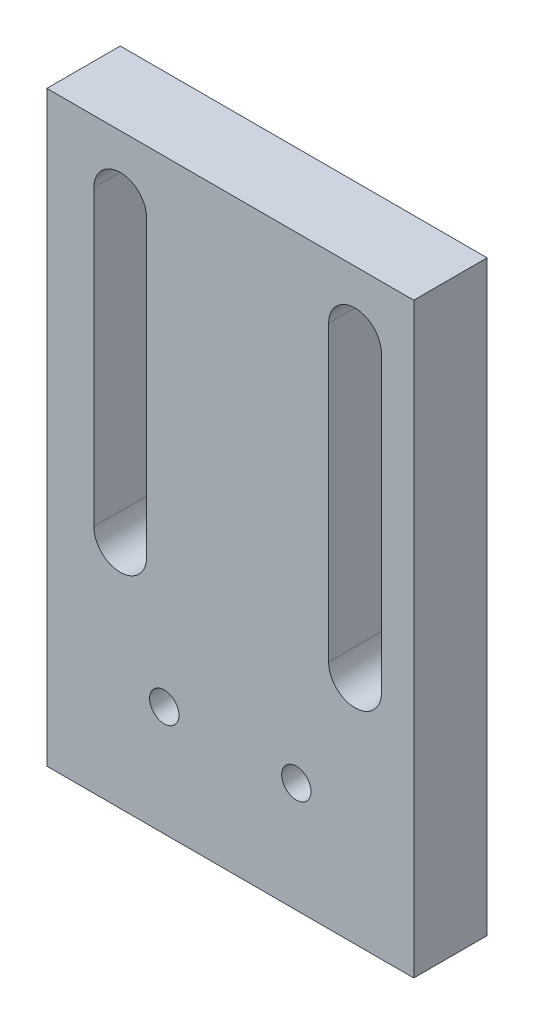
from build123d import *

# Parameters (mm, degrees)
SKETCH1_W           = 25
SKETCH1_H           = 40
SKETCH1_R           = 1
BOSS_EXTRUDE1_DEPTH = 5
SKETCH2_W           = 6.2
SKETCH2_H           = 6.2
CUT_EXTRUDE1_DEPTH  = 2.5


with BuildPart() as part:
    # Sketch1 → Boss-Extrude1 (new body)
    with BuildSketch(Plane.XY):
        with Locations((-0.5, 8.252788104)):
            Rectangle(SKETCH1_W, SKETCH1_H)
        with Locations((-5, -4.247211896)):
            Circle(SKETCH1_R, mode=Mode.SUBTRACT)
        with Locations((4, -4.247211896)):
            Circle(SKETCH1_R, mode=Mode.SUBTRACT)
        with BuildLine():
            Line((-6.2, 23.993504103), (-6.2, 3.993504103))
            ThreePointArc((-6.2, 3.993504103), (-8, 2.193504103), (-9.8, 3.993504103))
            Line((-9.8, 3.993504103), (-9.8, 23.993504103))
            ThreePointArc((-9.8, 23.993504103), (-8, 25.793504103), (-6.2, 23.993504103))
        make_face(mode=Mode.SUBTRACT)
        with BuildLine():
            Line((6.2, 23.993504103), (6.2, 3.993504103))
            ThreePointArc((6.2, 3.993504103), (8, 2.193504103), (9.8, 3.993504103))
            Line((9.8, 3.993504103), (9.8, 23.993504103))
            ThreePointArc((9.8, 23.993504103), (8, 25.793504103), (6.2, 23.993504103))
        make_face(mode=Mode.SUBTRACT)
    extrude(amount=BOSS_EXTRUDE1_DEPTH)

    # Sketch2 → Cut-Extrude1 (cut)
    with BuildSketch(Plane(origin=(0, 0, 0), x_dir=(-1, 0, 0), z_dir=(0, 0, -1))):
        with Locations((-4, -4.247211896)):
            Rectangle(SKETCH2_W, SKETCH2_H)
        with Locations((5, -4.247211896)):
            Rectangle(SKETCH2_W, SKETCH2_H)
    extrude(amount=-CUT_EXTRUDE1_DEPTH, mode=Mode.SUBTRACT)


solid = part.part
